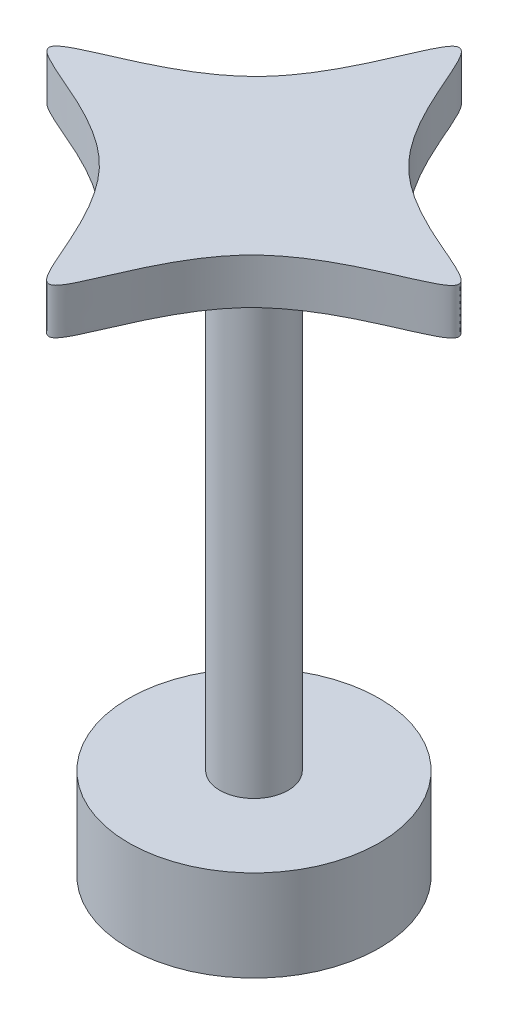
from build123d import *

# Parameters (mm, degrees)
SKETCH1_R           = 17.4625
BOSS_EXTRUDE1_DEPTH = 12.7
SKETCH2_R           = 4.7625
BOSS_EXTRUDE2_DEPTH = 66.675
BOSS_EXTRUDE3_DEPTH = 6.35


with BuildPart() as part:
    # Sketch1 → Boss-Extrude1 (new body)
    with BuildSketch(Plane(origin=(0, 0, 0), x_dir=(1, 0, 0), z_dir=(0, 1, 0))):
        with Locations(Location((0, 0, 0), (0, 0, 270))):
            Circle(SKETCH1_R)
    extrude(amount=BOSS_EXTRUDE1_DEPTH)

    # Sketch2 → Boss-Extrude2 (add)
    with BuildSketch(Plane(origin=(0, 12.7, 0), x_dir=(1, 0, 0), z_dir=(0, 1, 0))):
        with Locations(Location((0, 0, 0), (0, 0, 270))):
            Circle(SKETCH2_R)
    extrude(amount=BOSS_EXTRUDE2_DEPTH)

    # Sketch3 → Boss-Extrude3 (add)
    with BuildSketch(Plane(origin=(0, 79.375, 0), x_dir=(1, 0, 0), z_dir=(0, 1, 0))):
        with BuildLine():
            add(Edge.make_bspline(
                [(-10.558892025, 10.98942215), (-4.065120938, 17.556959254), (0.034148922, 39.751606205), (6.301971789, 6.143875829), (39.751606205, -0.034148922), (6.143875829, -6.301971789), (-0.034148922, -39.751606205), (-6.301971789, -6.143875829), (-39.751606205, 0.034148922), (-17.23984149, 4.232580416), (-10.558892025, 10.98942215)],
                knots=[0, 0, 0, 0, 0.123224076, 0.25, 0.373224076, 0.5, 0.623224076, 0.75, 0.873224076, 1, 1, 1, 1], degree=3))
        make_face()
    extrude(amount=BOSS_EXTRUDE3_DEPTH)


solid = part.part
